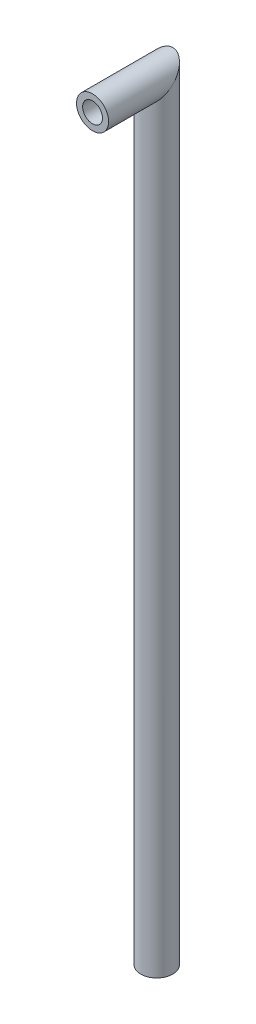
from build123d import *

# Parameters (mm, degrees)
SKETCH1_R           = 5
SKETCH2_R           = 3.1
CUT_EXTRUDE1_DEPTH  = 15
SKETCH4_W           = 3.376388604
SKETCH4_H           = 1
BOSS_EXTRUDE1_DEPTH = 9
SKETCH5_R           = 3.1
CUT_EXTRUDE2_DEPTH  = 240


with BuildPart() as part:
    # Sweep1: sweep along a curve in space
    with BuildLine() as sweep1_path:
        Line((0, 0, 0), (0, 0, -20))
        Line((0, 0, -20), (0, -240, -20))
    # Sketch1 → Sweep1 (sweep)
    with BuildSketch(Plane.XY):
        Circle(SKETCH1_R)
    sweep(path=sweep1_path.line, transition=Transition.RIGHT)

    # Sketch2 → Cut-Extrude1 (cut)
    with BuildSketch(Plane.XY):
        Circle(SKETCH2_R)
    extrude(amount=-CUT_EXTRUDE1_DEPTH, mode=Mode.SUBTRACT)

    # Sketch4 → Boss-Extrude1 (add)
    with BuildSketch(Plane.XY.offset(-15)):
        with Locations((0, -3.1)):
            Rectangle(SKETCH4_W, SKETCH4_H)
    extrude(amount=BOSS_EXTRUDE1_DEPTH)

    # Sketch5 → Cut-Extrude2 (cut)
    with BuildSketch(Plane.XZ.offset(240)):
        with Locations(Location((0, -20, 0), (0, 0, 270))):
            Circle(SKETCH5_R)
    extrude(amount=-CUT_EXTRUDE2_DEPTH, mode=Mode.SUBTRACT)


solid = part.part
